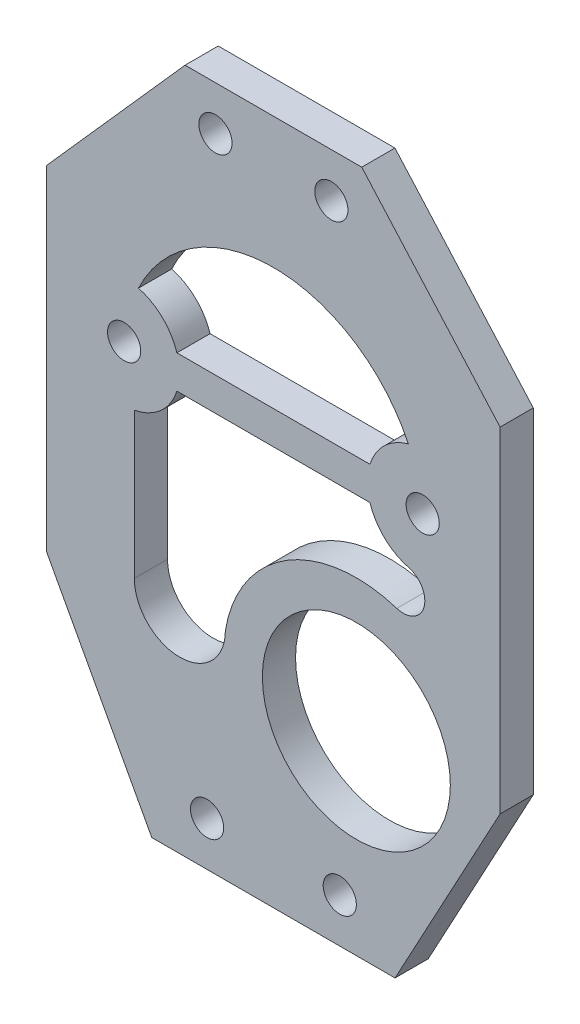
from build123d import *

# Parameters (mm, degrees)
SKETCH_1_R      = 8.5
SKETCH_1_R_2    = 1.5
SKETCH_1_W      = 17.460607986
SKETCH_1_H      = 3
EXTRUDE_1_DEPTH = 3


with BuildPart() as part:
    # 스케치1 → 보스-돌출1 (new body)
    # profile 1 of 2: a face of its own
    with BuildSketch(Plane.XY):
        Polygon((20.5, 17.599715907), (20.5, 47.899715907), (7.989824602, 62), (-7.989824602, 62), (-20.5, 47.899715907), (-20.5, 17.599715907), (-11, 0), (11, 0), align=None)
        with Locations((7.5, 17.599715907)):
            Circle(SKETCH_1_R, mode=Mode.SUBTRACT)
        with Locations((13.5, 37.599715907)):
            Circle(SKETCH_1_R_2, mode=Mode.SUBTRACT)
        with Locations((-5.239824602, 58)):
            Circle(SKETCH_1_R_2, mode=Mode.SUBTRACT)
        with Locations((-6, 4)):
            Circle(SKETCH_1_R_2, mode=Mode.SUBTRACT)
        with Locations((-13.5, 37.599715907)):
            Circle(SKETCH_1_R_2, mode=Mode.SUBTRACT)
        with Locations((6, 4)):
            Circle(SKETCH_1_R_2, mode=Mode.SUBTRACT)
        with Locations((5.239824602, 58)):
            Circle(SKETCH_1_R_2, mode=Mode.SUBTRACT)
        with BuildLine():
            ThreePointArc((11.156743405, 29.02898656), (13.621468977, 30.35740093), (12.202349665, 32.771040767))
            ThreePointArc((12.202349665, 32.771040767), (10.039769884, 33.990449008), (8.730303993, 36.099715907))
            Line((8.730303993, 36.099715907), (8.730303993, 39.099715907))
            ThreePointArc((8.730303993, 39.099715907), (10.039769884, 41.208982805), (12.202349665, 42.428391047))
            ThreePointArc((12.202349665, 42.428391047), (0, 50.15321463), (-12.202349665, 42.428391047))
            ThreePointArc((-12.202349665, 42.428391047), (-10.039769884, 41.208982805), (-8.730303993, 39.099715907))
            Line((-8.730303993, 39.099715907), (-8.730303993, 36.099715907))
            ThreePointArc((-8.730303993, 36.099715907), (-10.181651088, 33.8595875), (-12.578672362, 32.685333404))
            Line((-12.578672362, 32.685333404), (-12.578672362, 19.505123412))
            ThreePointArc((-12.578672362, 19.505123412), (-8.463216291, 15.389667341), (-4.34776022, 19.505123412))
            ThreePointArc((-4.34776022, 19.505123412), (1.219141664, 27.824725372), (11.156743405, 29.02898656))
        make_face(mode=Mode.SUBTRACT)
    # profile 2 of 2: a face of its own
    with BuildSketch(Plane.XY):
        with Locations((0, 37.599715907)):
            Rectangle(SKETCH_1_W, SKETCH_1_H)
    extrude(amount=EXTRUDE_1_DEPTH)


solid = part.part
